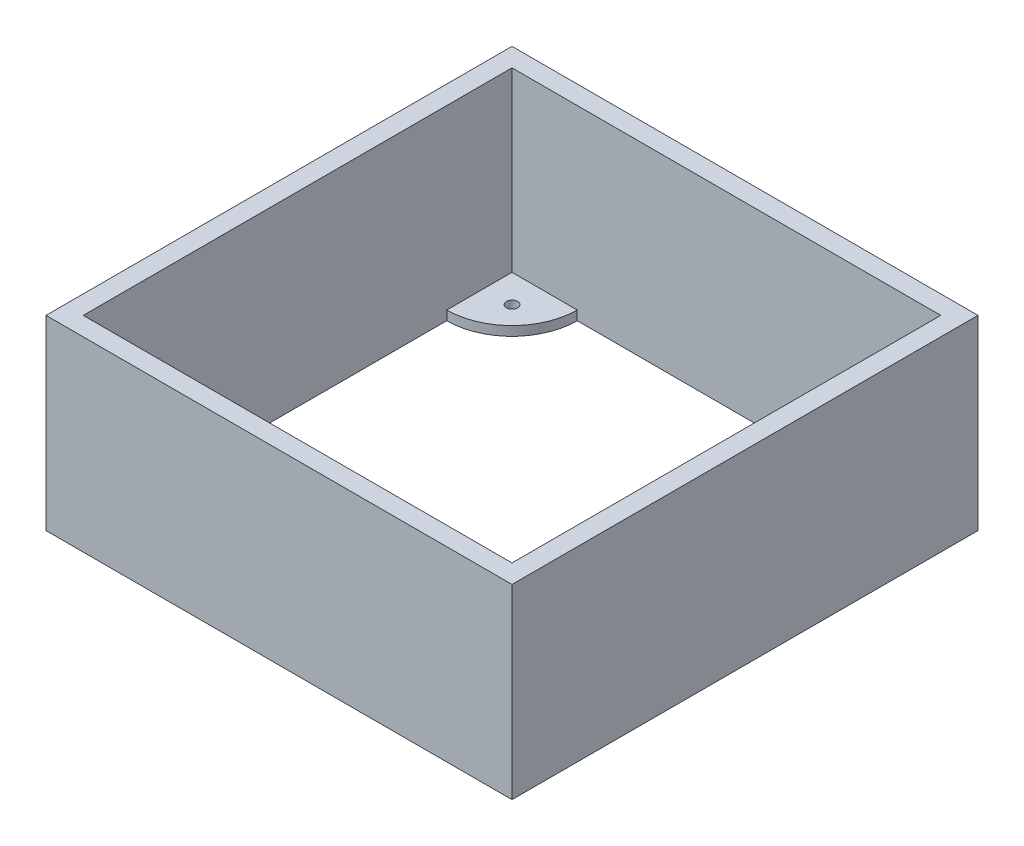
from build123d import *

# Parameters (mm, degrees)
SKETCH1_W            = 100
SKETCH1_H            = 100
SKETCH1_W_2          = 92
SKETCH1_H_2          = 92
BOSS_EXTRUDE1_DEPTH  = 40
BOSS_EXTRUDE2_DEPTH  = 2
M2_CLEARANCE_HOLE1_D = 2.4


with BuildPart() as part:
    # Sketch1 → Boss-Extrude1 (new body)
    with BuildSketch(Plane(origin=(0, 0, 0), x_dir=(1, 0, 0), z_dir=(0, 1, 0))):
        Rectangle(SKETCH1_W, SKETCH1_H)
        Rectangle(SKETCH1_W_2, SKETCH1_H_2, mode=Mode.SUBTRACT)
    extrude(amount=BOSS_EXTRUDE1_DEPTH)

    # Sketch2 → Boss-Extrude2 (add)
    with BuildSketch(Plane(origin=(0, 0, 0), x_dir=(-1, 0, 0), z_dir=(0, -1, 0))):
        with BuildLine():
            Line((-46, 32), (-46, 46))
            Line((-46, 46), (-32, 46))
            ThreePointArc((-32, 46), (-36.100505063, 36.100505063), (-46, 32))
        make_face()
        with BuildLine():
            Line((32, 46), (46, 46))
            Line((46, 46), (46, 32))
            ThreePointArc((46, 32), (36.100505063, 36.100505063), (32, 46))
        make_face()
        with BuildLine():
            Line((46, -32), (46, -46))
            Line((46, -46), (32, -46))
            ThreePointArc((32, -46), (36.100505063, -36.100505063), (46, -32))
        make_face()
        with BuildLine():
            Line((-32, -46), (-46, -46))
            Line((-46, -46), (-46, -32))
            ThreePointArc((-46, -32), (-36.100505063, -36.100505063), (-32, -46))
        make_face()
    extrude(amount=-BOSS_EXTRUDE2_DEPTH)

    # M2 Clearance Hole1 (through all)
    with Locations(Plane(origin=(40, 0, 40), x_dir=(0, 0, -1), z_dir=(0, -1, 0))):
        with Locations((0, 0), (80, 0), (80, -80), (0, -80)):
            Hole(M2_CLEARANCE_HOLE1_D / 2)


solid = part.part
